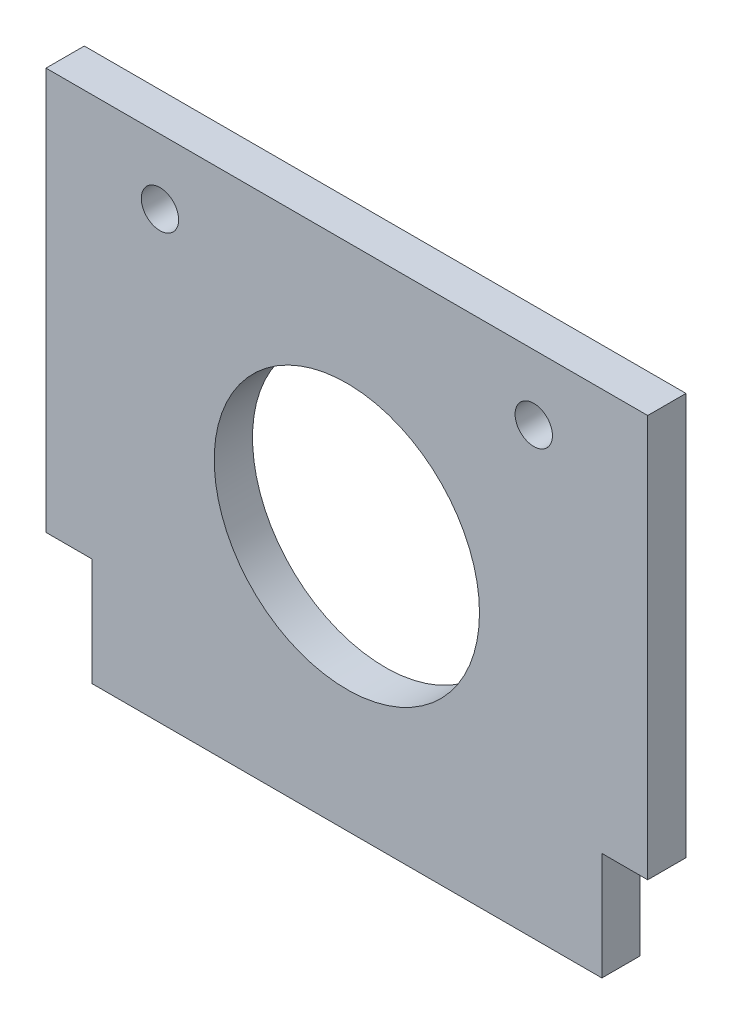
from build123d import *

# Parameters (mm, degrees)
SKETCH1_R           = 11
SKETCH1_R_2         = 1.55
BOSS_EXTRUDE1_DEPTH = 3.175


with BuildPart() as part:
    # Sketch1 → Boss-Extrude1 (new body)
    with BuildSketch(Plane.XY):
        Polygon((0, 0), (42.3, 0), (42.3, 8.950102459), (46.1, 8.950102459), (46.1, 42.3), (42.3, 42.3), (0, 42.3), (-3.8, 42.3), (-3.8, 8.950102459), (0, 8.950102459), align=None)
        with Locations((21.15, 21.15)):
            Circle(SKETCH1_R, mode=Mode.SUBTRACT)
        with Locations((36.65, 36.9)):
            Circle(SKETCH1_R_2, mode=Mode.SUBTRACT)
        with Locations((5.65, 36.9)):
            Circle(SKETCH1_R_2, mode=Mode.SUBTRACT)
    extrude(amount=BOSS_EXTRUDE1_DEPTH)


solid = part.part
